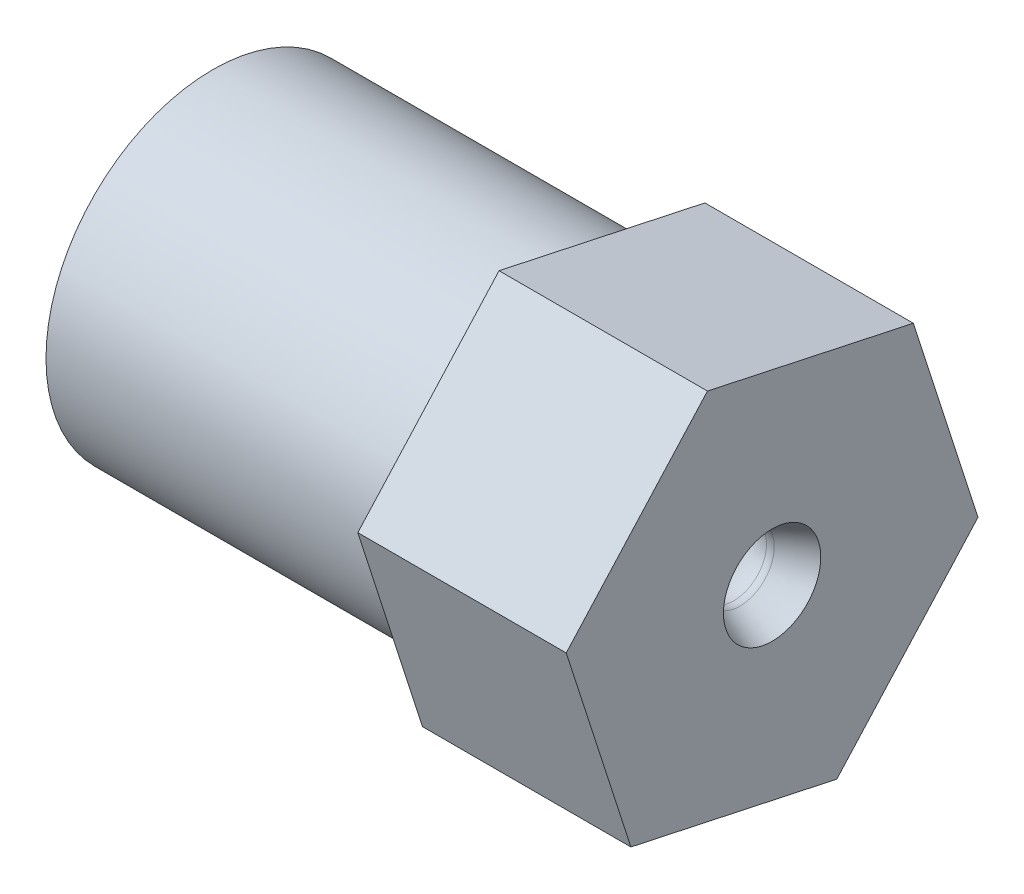
from build123d import *

# Parameters (mm, degrees)
SKETCH4_R           = 10.16
BOSS_EXTRUDE1_DEPTH = 12.7
FILLET1_R           = 0.635


with BuildPart() as part:
    # Sketch1 → Revolve1 (revolve)
    with BuildSketch(Plane.XY, mode=Mode.PRIVATE) as revolve1_sk:
        with BuildLine():
            Line((-2.121320344, 2.878679656), (-2.757704717, 3.51506403))
            ThreePointArc((-2.757704717, 3.51506403), (-3.78774885, 4.203317516), (-5.002768748, 4.445))
            Line((-5.002768748, 4.445), (-13.462, 4.445))
            Line((-13.462, 4.445), (-13.462, 4.699))
            ThreePointArc((-13.462, 4.699), (-13.499197439, 4.788802561), (-13.589, 4.826))
            Line((-13.589, 4.826), (-19.304, 4.826))
            ThreePointArc((-19.304, 4.826), (-19.753012806, 5.011987194), (-19.939, 5.461))
            Line((-19.939, 5.461), (-19.939, 6.8199))
            ThreePointArc((-19.939, 6.8199), (-19.976197439, 6.909702561), (-20.066, 6.9469))
            Line((-20.066, 6.9469), (-24.892, 6.9469))
            Line((-24.892, 6.9469), (-24.892, 7.8994))
            ThreePointArc((-24.892, 7.8994), (-24.929197439, 7.989202561), (-25.019, 8.0264))
            Line((-25.019, 8.0264), (-31.115, 8.0264))
            ThreePointArc((-31.115, 8.0264), (-31.564012806, 8.212387194), (-31.75, 8.6614))
            Line((-31.75, 8.6614), (-31.75, 10.16))
            Line((-31.75, 10.16), (-10.362192304, 10.16))
            Line((-10.362192304, 10.16), (2.337807696, 10.16))
            Line((2.337807696, 10.16), (2.337807696, 2.966479395))
            add(Edge.make_bspline(
                [(2.337807696, 2.966479395), (1.321354961, 2.596520855), (0.37557725, 2.093641926)],
                knots=[0, 0, 0, 1, 1, 1], degree=2))
            ThreePointArc((0.37557725, 2.093641926), (0.193537516, 2.023763419), (0, 2))
            ThreePointArc((0, 2), (-1.148050297, 2.228361402), (-2.121320344, 2.878679656))
        make_face()
    revolve(revolve1_sk.sketch.rotate(Axis((0, 0, 0), (1, 0, 0)), 90), axis=Axis((0, 0, 0), (1, 0, 0)))

    # Sketch4 → Boss-Extrude1 (add)
    with BuildSketch(Plane(origin=(2.337807696, 0, 0), x_dir=(0, 0, -1), z_dir=(1, 0, 0))):
        Polygon((3.940411868, -12.211607701), (12.545768424, -2.693307071), (8.605356556, 9.51830063), (-3.940411868, 12.211607701), (-12.545768424, 2.693307071), (-8.605356556, -9.51830063), align=None)
        with Locations(Location((0, 0, 0), (0, 0, 180))):
            Circle(SKETCH4_R, mode=Mode.SUBTRACT)
    extrude(amount=-BOSS_EXTRUDE1_DEPTH)

    # Fillet1
    fillet1_edges = [part.edges().sort_by_distance(p)[0] for p in [
        (-10.362192304, 0, -10.16),
    ]]
    fillet(fillet1_edges, radius=FILLET1_R)


solid = part.part
